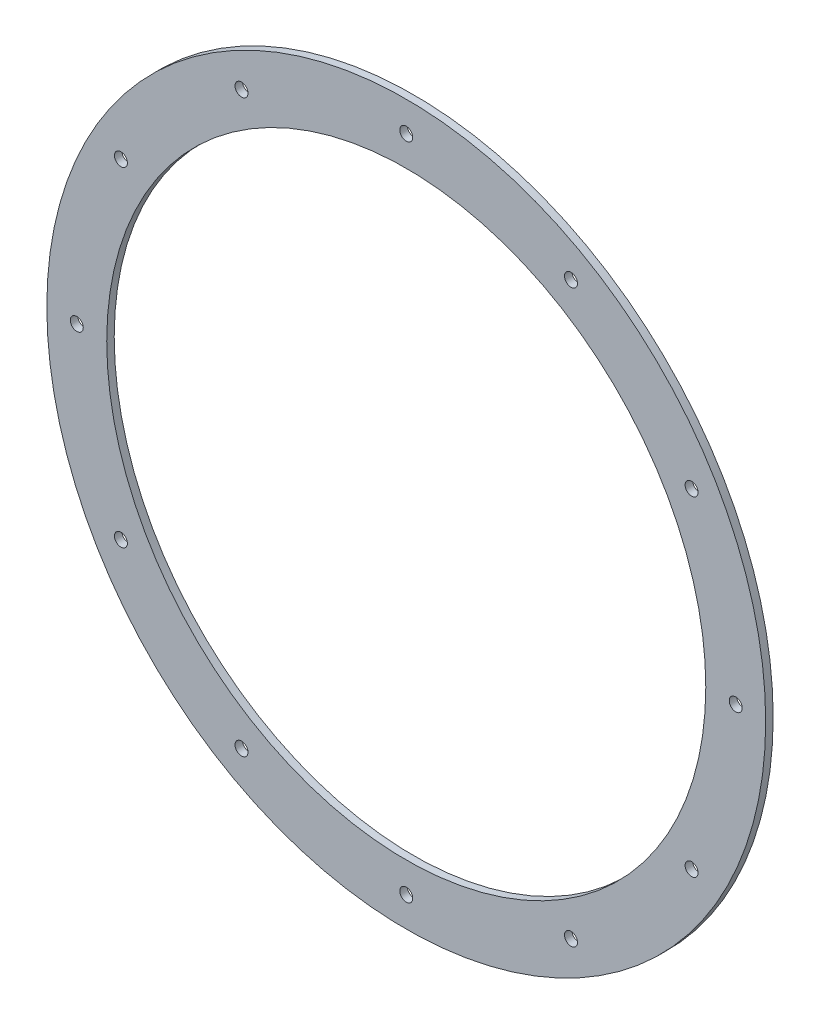
from build123d import *

# Parameters (mm, degrees)
SKETCH1_R           = 609.6
SKETCH1_R_2         = 508
BOSS_EXTRUDE1_DEPTH = 12.7
SKETCH2_R           = 11
CUT_EXTRUDE1_DEPTH  = 12.7


with BuildPart() as part:
    # Sketch1 → Boss-Extrude1 (new body)
    with BuildSketch(Plane.XY):
        Circle(SKETCH1_R)
        Circle(SKETCH1_R_2, mode=Mode.SUBTRACT)
    extrude(amount=BOSS_EXTRUDE1_DEPTH)

    # Sketch2 → Cut-Extrude1 (cut)
    with BuildSketch(Plane.XY):
        with Locations((0, 215.685000111)):
            Circle(SKETCH2_R)
        with Locations((0, 558.8)):
            Circle(SKETCH2_R)
        with Locations((279.4, 483.934995635)):
            Circle(SKETCH2_R)
        with Locations((483.934995635, 279.4)):
            Circle(SKETCH2_R)
        with Locations((558.8, 0)):
            Circle(SKETCH2_R)
        with Locations((483.934995635, -279.4)):
            Circle(SKETCH2_R)
        with Locations((279.4, -483.934995635)):
            Circle(SKETCH2_R)
        with Locations((0, -558.8)):
            Circle(SKETCH2_R)
        with Locations((-279.4, -483.934995635)):
            Circle(SKETCH2_R)
        with Locations((-483.934995635, -279.4)):
            Circle(SKETCH2_R)
        with Locations((-558.8, 0)):
            Circle(SKETCH2_R)
        with Locations((-483.934995635, 279.4)):
            Circle(SKETCH2_R)
        with Locations((-279.4, 483.934995635)):
            Circle(SKETCH2_R)
    extrude(amount=CUT_EXTRUDE1_DEPTH, mode=Mode.SUBTRACT)


solid = part.part
